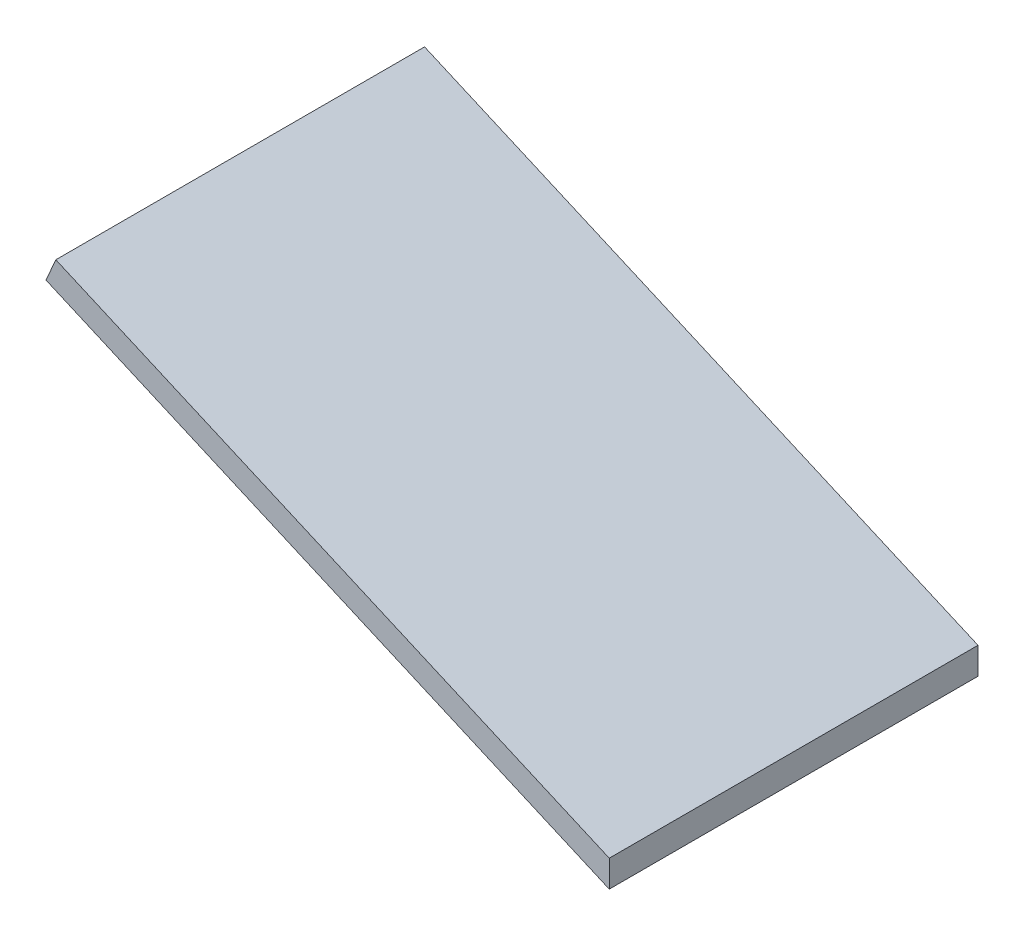
from build123d import *

# Parameters (mm, degrees)
RESSALTO_EXTRUS_O1_DEPTH = 30


with BuildPart() as part:
    # Esboço2 → Ressalto-extrusão1 (new body)
    with BuildSketch(Plane.XY):
        Polygon((22.912878475, -10), (-22.912878475, 10), (-22.112878475, 11.833030278), (22.912878475, -7.817821098), align=None)
    extrude(amount=RESSALTO_EXTRUS_O1_DEPTH)


solid = part.part
